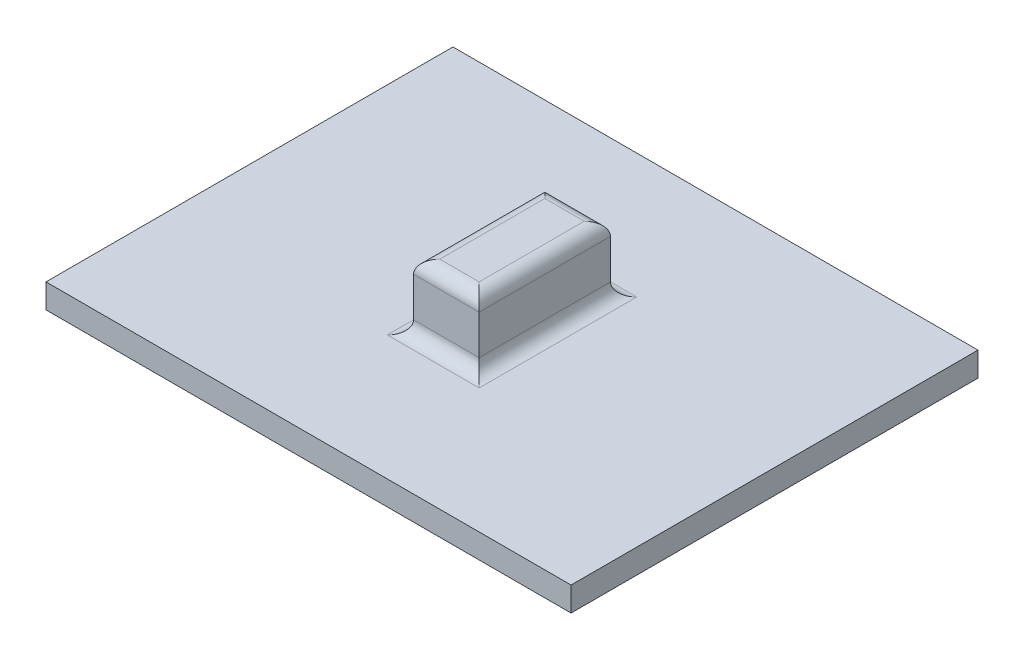
from build123d import *

# Parameters (mm, degrees)
SKETCH1_W           = 80
SKETCH1_H           = 62
BOSS_EXTRUDE1_DEPTH = 3.7
SKETCH2_W           = 10
SKETCH2_H           = 20
BOSS_EXTRUDE2_DEPTH = 10
FILLET1_R           = 2
FILLET2_R           = 2


with BuildPart() as part:
    # Sketch1 → Boss-Extrude1 (new body)
    with BuildSketch(Plane(origin=(0, 0, 0), x_dir=(1, 0, 0), z_dir=(0, 1, 0))):
        with Locations((40, 31)):
            Rectangle(SKETCH1_W, SKETCH1_H)
    extrude(amount=BOSS_EXTRUDE1_DEPTH)

    # Sketch2 → Boss-Extrude2 (add)
    with BuildSketch(Plane(origin=(0, 3.7, 0), x_dir=(1, 0, 0), z_dir=(0, 1, 0))):
        with Locations((40, 31)):
            Rectangle(SKETCH2_W, SKETCH2_H)
    extrude(amount=BOSS_EXTRUDE2_DEPTH)

    # Fillet1
    fillet1_edges = [part.edges().sort_by_distance(p)[0] for p in [
        (35, 3.7, -31),
        (40, 3.7, -21),
        (45, 3.7, -31),
        (40, 3.7, -41),
    ]]
    fillet(fillet1_edges, radius=FILLET1_R)

    # Fillet2
    fillet2_edges = [part.edges().sort_by_distance(p)[0] for p in [
        (35, 13.7, -31),
        (40, 13.7, -21),
        (45, 13.7, -31),
        (40, 13.7, -41),
    ]]
    fillet(fillet2_edges, radius=FILLET2_R)


solid = part.part
